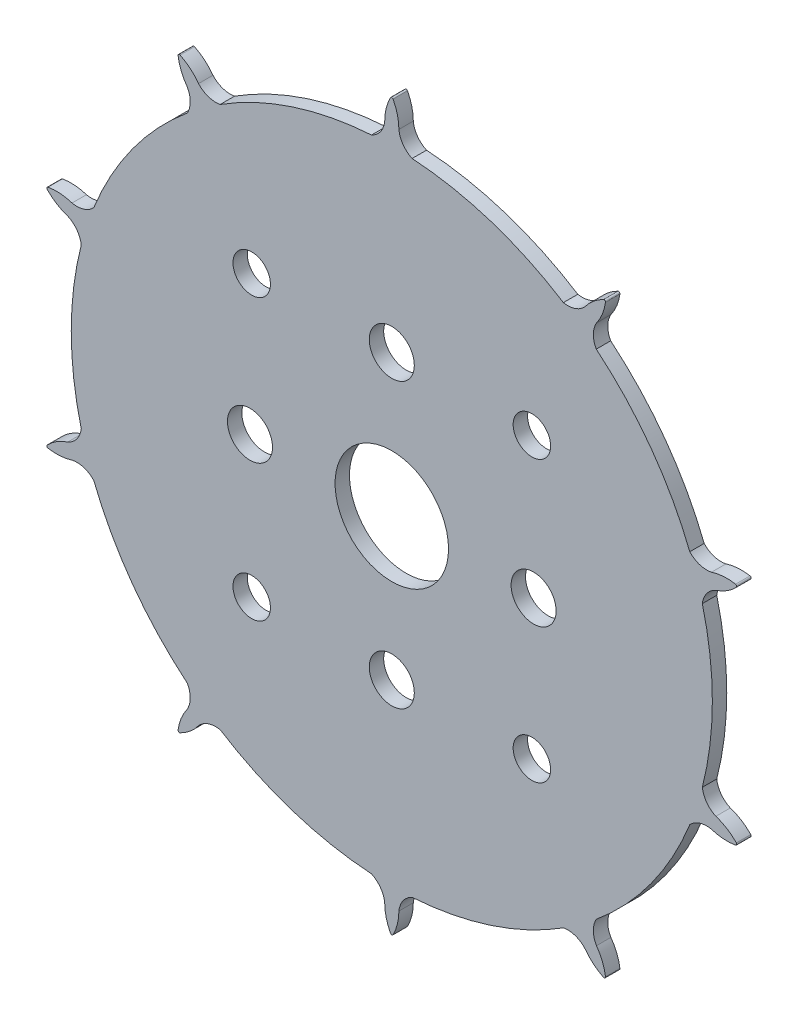
from build123d import *

# Parameters (mm, degrees)
SKETCH1_R           = 22.6042
SKETCH1_R_2         = 1.5875
SKETCH1_R_3         = 1.3208
SKETCH1_R_4         = 4
BOSS_EXTRUDE2_DEPTH = 1.016
BOSS_EXTRUDE4_DEPTH = 1.016
CIRPATTERN1_COUNT   = 10


with BuildPart() as part:
    # Sketch1 → Boss-Extrude2 (new body)
    with BuildSketch(Plane.XY):
        Circle(SKETCH1_R)
        with Locations((0, 10)):
            Circle(SKETCH1_R_2, mode=Mode.SUBTRACT)
        with Locations((9.878281733, -9.878281733)):
            Circle(SKETCH1_R_3, mode=Mode.SUBTRACT)
        with Locations((9.878281733, 9.878281733)):
            Circle(SKETCH1_R_3, mode=Mode.SUBTRACT)
        with Locations((-9.878281733, -9.878281733)):
            Circle(SKETCH1_R_3, mode=Mode.SUBTRACT)
        with Locations((-9.878281733, 9.878281733)):
            Circle(SKETCH1_R_3, mode=Mode.SUBTRACT)
        Circle(SKETCH1_R_4, mode=Mode.SUBTRACT)
        with Locations((10, 0)):
            Circle(SKETCH1_R_2, mode=Mode.SUBTRACT)
        with Locations((0, -10)):
            Circle(SKETCH1_R_2, mode=Mode.SUBTRACT)
        with Locations((-10, 0)):
            Circle(SKETCH1_R_2, mode=Mode.SUBTRACT)
    extrude(amount=BOSS_EXTRUDE2_DEPTH)

    # Sketch2 → Boss-Extrude4 (add)
    with BuildSketch(Plane.XY.offset(1.016)):
        with BuildLine():
            ThreePointArc((0.499966183, 23.867964213), (0.39548978, 24.71817963), (0.088277099, 25.517805758))
            ThreePointArc((0.088277099, 25.517805758), (2.11e-07, 25.570824608), (-0.088276453, 25.517805384))
            ThreePointArc((-0.088276453, 25.517805384), (-0.395485603, 24.718178984), (-0.499958974, 23.867964213))
            ThreePointArc((-0.499958974, 23.867964213), (-0.860359014, 23.002073844), (-1.63911586, 22.479396033))
            ThreePointArc((-1.63911586, 22.479396033), (3.604e-06, 22.249732232), (1.639123068, 22.479396033))
            ThreePointArc((1.639123068, 22.479396033), (0.860366222, 23.002073844), (0.499966183, 23.867964213))
        make_face()
    boss_extrude4 = extrude(amount=-BOSS_EXTRUDE4_DEPTH)

    # CirPattern1: Boss-Extrude4 ×10 about axis
    cirpattern1_axis = Axis((0, 0, 0), (0, 0, 1))
    for i in range(1, CIRPATTERN1_COUNT):
        add(boss_extrude4.rotate(cirpattern1_axis, i * 360 / CIRPATTERN1_COUNT))


solid = part.part
